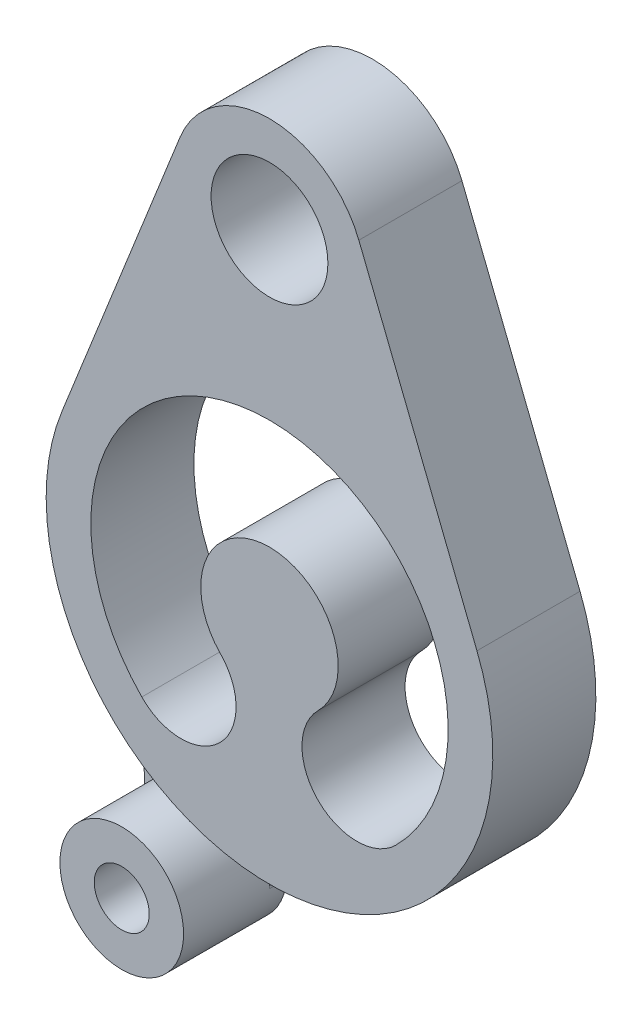
from build123d import *

# Parameters (mm, degrees)
SKETCH2_R           = 17
BOSS_EXTRUDE1_DEPTH = 30
SKETCH2_4_R         = 18
SKETCH2_4_R_2       = 8
BOSS_EXTRUDE2_DEPTH = 30
BOSS_EXTRUDE3_DEPTH = 5


with BuildPart() as part:
    # Sketch2 → Boss-Extrude1 (new body)
    with BuildSketch(Plane.XY):
        with BuildLine():
            Line((60.387064012, -75.95), (26.012889113, 10.36))
            ThreePointArc((26.012889113, 10.36), (0, 28), (-26.012889113, 10.36))
            Line((-26.012889113, 10.36), (-60.387064012, -75.95))
            ThreePointArc((-60.387064012, -75.95), (-63.836349993, -87.755800573), (-65, -100))
            Line((-65, -100), (-64.745963704, -105.741096069))
            ThreePointArc((-64.745963704, -105.741096069), (-43.885241002, -147.948781238), (0, -165))
            ThreePointArc((0, -165), (53.797072411, -136.481159521), (60.387064012, -75.95))
        make_face()
        with BuildLine():
            ThreePointArc((-37.165332046, -136.369466506), (0.28138508, -48.000761328), (36.769552622, -136.769552622))
            ThreePointArc((36.769552622, -136.769552622), (14.142135624, -136.769552622), (14.142135624, -114.142135624))
            ThreePointArc((14.142135624, -114.142135624), (0.108225031, -80.000292819), (-14.294358479, -113.988256349))
            ThreePointArc((-14.294358479, -113.988256349), (-14.539240183, -136.614348211), (-37.165332046, -136.369466506))
        make_face(mode=Mode.SUBTRACT)
        Circle(SKETCH2_R, mode=Mode.SUBTRACT)
    extrude(amount=BOSS_EXTRUDE1_DEPTH)



with BuildPart() as body_2:
    # Sketch2<4> → Boss-Extrude2 (new body)
    with BuildSketch(Plane.XY):
        with Locations((-43, -190)):
            Circle(SKETCH2_4_R)
        with Locations((-43, -190)):
            Circle(SKETCH2_4_R_2, mode=Mode.SUBTRACT)
    extrude(amount=BOSS_EXTRUDE2_DEPTH)


with BuildPart() as part_1:
    add(part.part)

    add(body_2.part)  # Boss-Extrude3 merges body 2
    # Sketch3 → Boss-Extrude3 (add)
    with BuildSketch(Plane.XY):
        with BuildLine():
            ThreePointArc((2.030385563, -164.968280987), (-43.130914594, -148.62843002), (-64.745963704, -105.741096069))
            Line((-64.745963704, -105.741096069), (-61, -190))
            ThreePointArc((-61, -190), (-43, -172), (-25, -190))
            ThreePointArc((-25, -190), (-25.009294588, -190.578375974), (-25.037168752, -191.15615464))
            ThreePointArc((-25.037168752, -191.15615464), (-16.564278272, -172.831330157), (2.030385563, -164.968280987))
        make_face()
    extrude(amount=BOSS_EXTRUDE3_DEPTH)


solid = part_1.part
